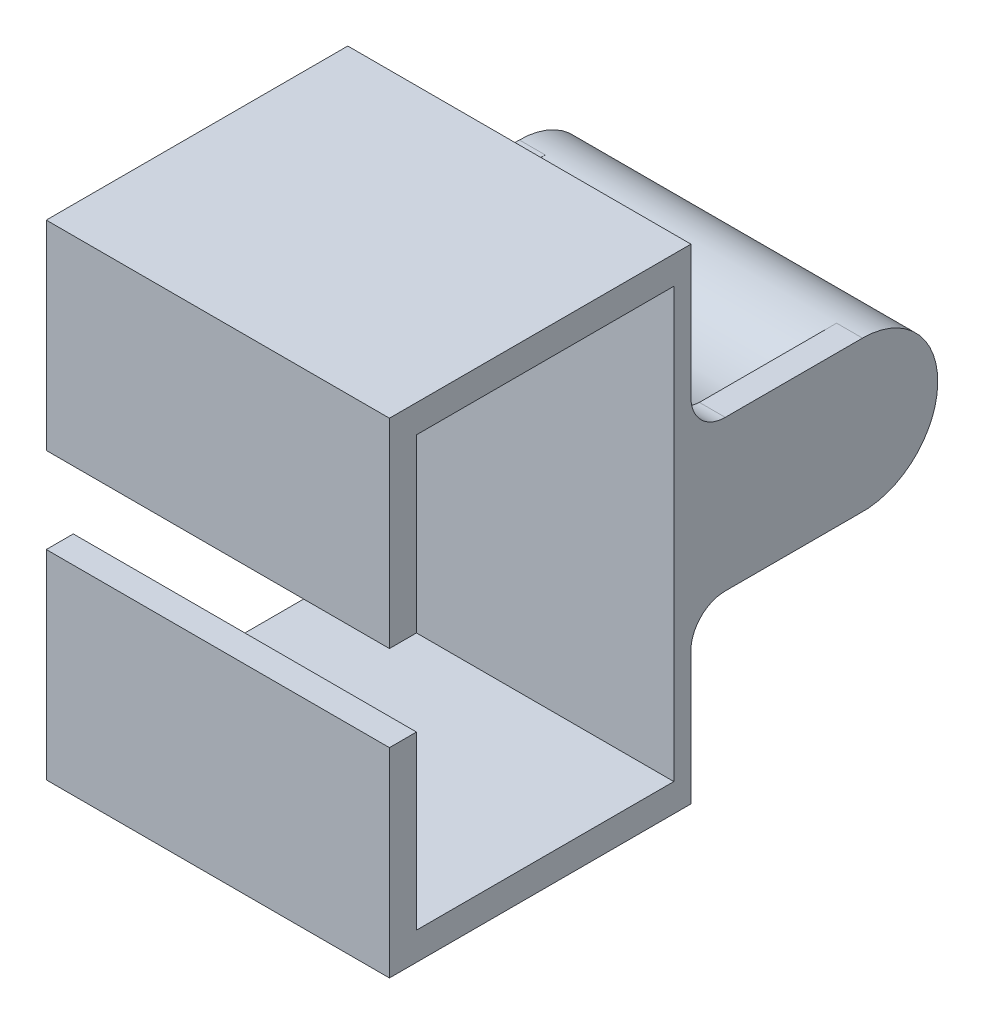
from build123d import *

# Parameters (mm, degrees)
SKETCH1_R           = 11.136121628
BOSS_EXTRUDE1_DEPTH = 50.8
SKETCH2_W           = 22.261321628
SKETCH2_H           = 25.4
BOSS_EXTRUDE2_DEPTH = 3.834635566
SKETCH3_W           = 63.5
SKETCH3_H           = 2.530898103
BOSS_EXTRUDE3_DEPTH = 50.8
SKETCH4_W           = 4.132939296
SKETCH4_H           = 40.630898103
BOSS_EXTRUDE4_DEPTH = 50.8
SKETCH5_W           = 29.532939296
SKETCH5_H           = 4.001701266
BOSS_EXTRUDE5_DEPTH = 50.8
SKETCH6_W           = 22.261321628
SKETCH6_H           = 25.4
BOSS_EXTRUDE6_DEPTH = 3.834635566
FILLET2_R           = 5.08


with BuildPart() as part:
    # Sketch1 → Boss-Extrude1 (new body)
    with BuildSketch(Plane.YZ):
        with Locations(Location((0, 0, 0), (0, 0, 270))):
            Circle(SKETCH1_R)
    extrude(amount=BOSS_EXTRUDE1_DEPTH)

    # Sketch2 → Boss-Extrude2 (add)
    with BuildSketch(Plane(origin=(0, 0, 0), x_dir=(0, -1, 0), z_dir=(-1, 0, 0))):
        with Locations((-0.005460814, 12.7)):
            Rectangle(SKETCH2_W, SKETCH2_H)
    extrude(amount=-BOSS_EXTRUDE2_DEPTH)

    # Sketch3 → Boss-Extrude3 (add)
    with BuildSketch(Plane.YZ):
        with Locations((0, 26.665449052)):
            Rectangle(SKETCH3_W, SKETCH3_H)
    extrude(amount=BOSS_EXTRUDE3_DEPTH)

    # Sketch4 → Boss-Extrude4 (add)
    with BuildSketch(Plane.YZ):
        with Locations((-33.816469648, 45.715449052)):
            Rectangle(SKETCH4_W, SKETCH4_H)
        with Locations((33.816469648, 45.715449052)):
            Rectangle(SKETCH4_W, SKETCH4_H)
    extrude(amount=BOSS_EXTRUDE4_DEPTH)

    # Sketch5 → Boss-Extrude5 (add)
    with BuildSketch(Plane.YZ):
        with Locations((-21.116469648, 68.031748736)):
            Rectangle(SKETCH5_W, SKETCH5_H)
        with Locations((21.116469648, 68.031748736)):
            Rectangle(SKETCH5_W, SKETCH5_H)
    extrude(amount=BOSS_EXTRUDE5_DEPTH)

    # Sketch6 → Boss-Extrude6 (add)
    with BuildSketch(Plane.YZ.offset(50.8)):
        with Locations((0.005460814, 12.7)):
            Rectangle(SKETCH6_W, SKETCH6_H)
    extrude(amount=-BOSS_EXTRUDE6_DEPTH)

    # Fillet2
    fillet2_edges = [part.edges().sort_by_distance(p)[0] for p in [
        (1.917317783, 11.136121628, 25.4),
        (3.834635566, 0.005460814, 25.4),
        (1.917317783, -11.1252, 25.4),
        (46.965364434, 0.005460814, 25.4),
        (48.882682217, -11.1252, 25.4),
        (48.882682217, 11.136121628, 25.4),
    ]]
    fillet(fillet2_edges, radius=FILLET2_R)


solid = part.part
